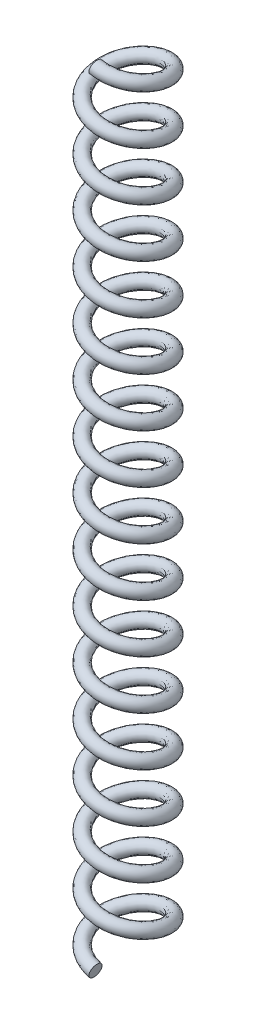
from build123d import *

# Parameters (mm, degrees)
COIL_WIRE_PITCH     = 3.764242732
COIL_WIRE_HEIGHT    = 60.227883705
COIL_WIRE_RADIUS    = 2.5
COIL_WIRE_PROFILE_R = 0.5


with BuildPart() as part:
    # Coil_Wire: sweep along a helix
    with BuildLine() as coil_wire_path:
        Helix(COIL_WIRE_PITCH, COIL_WIRE_HEIGHT, COIL_WIRE_RADIUS, center=(0, 0, 0), direction=(0, 1, 0), lefthand=True)
    # Coil_Wire profile (on start of the path) → Coil_Wire (sweep)
    with BuildSketch(Plane(origin=(0, 0, 2.5), x_dir=(-0.23304112234659066, -0.9724668813360388, 0), z_dir=(-0.9724668813360388, 0.23304112234659066, 1.763491187000308e-13))):
        Circle(COIL_WIRE_PROFILE_R)
    sweep(path=coil_wire_path.line, is_frenet=True)


solid = part.part
